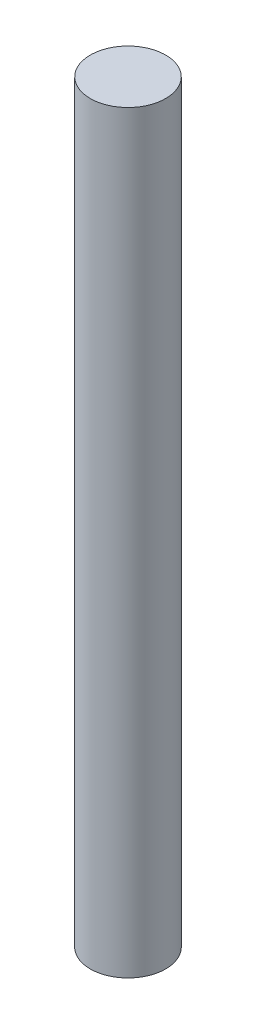
from build123d import *

# Parameters (mm, degrees)
SKETCH1_R           = 2.5
BOSS_EXTRUDE1_DEPTH = 50


with BuildPart() as part:
    # Sketch1 → Boss-Extrude1 (new body)
    with BuildSketch(Plane(origin=(0, 0, 0), x_dir=(1, 0, 0), z_dir=(0, 1, 0))):
        with Locations(Location((0, 0, 0), (0, 0, 270))):
            Circle(SKETCH1_R)
    extrude(amount=BOSS_EXTRUDE1_DEPTH)


solid = part.part
